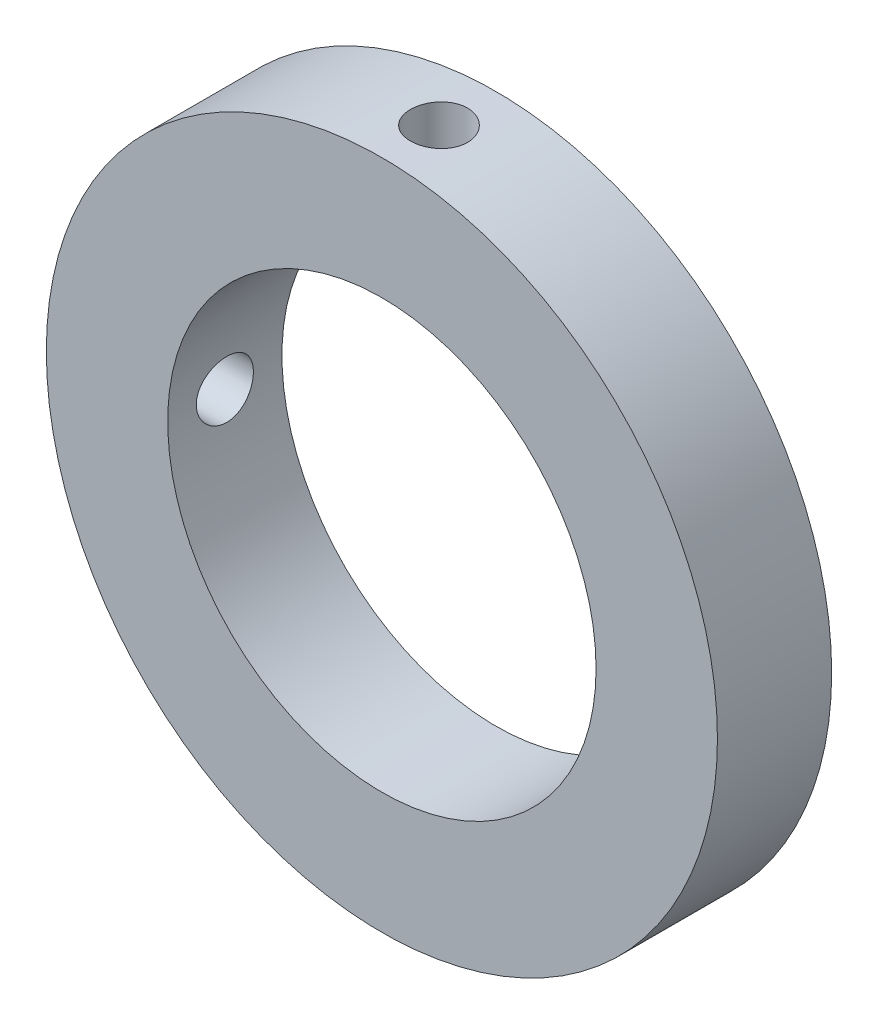
from build123d import *

# Parameters (mm, degrees)
SKETCH1_R               = 23.5
SKETCH1_R_2             = 15
BOSS_EXTRUDE1_DEPTH     = 8
CUT_EXTRUDE1_REACH      = 55.153
CUT_EXTRUDE1_END_RADIUS = 15
SKETCH3_R               = 2
CIRPATTERN1_COUNT       = 2
CIRPATTERN1_ANGLE       = 90


with BuildPart() as part:
    # Sketch1 → Boss-Extrude1 (new body)
    with BuildSketch(Plane.XY):
        Circle(SKETCH1_R)
        Circle(SKETCH1_R_2, mode=Mode.SUBTRACT)
    extrude(amount=BOSS_EXTRUDE1_DEPTH)

    # Cut-Extrude1: up to this cylinder (the profile starts outside it)
    cut_extrude1_end = Plane(origin=(0, 0, 4), z_dir=(0, 0, -1)) * Cylinder(CUT_EXTRUDE1_END_RADIUS, 141.306, mode=Mode.PRIVATE)
    # Sketch3 → Cut-Extrude1 (cut, up to the surface)
    with BuildSketch(Plane(origin=(0, 23.5, 8), x_dir=(1, 0, 0), z_dir=(0, 1, 0)), mode=Mode.PRIVATE) as cut_extrude1_sk1:
        with Locations(Location((0, 4, 0), (0, 0, 270))):
            Circle(SKETCH3_R)
    cut_extrude1_tool1 = extrude(cut_extrude1_sk1.sketch, amount=-CUT_EXTRUDE1_REACH, mode=Mode.PRIVATE) - cut_extrude1_end
    cut_extrude1 = cut_extrude1_tool1.solids().sort_by_distance((0, 23.5, 4))[0]
    add(cut_extrude1, mode=Mode.SUBTRACT)

    # CirPattern1: Cut-Extrude1 ×2 about axis
    cirpattern1_axis = Axis((0, 0, 8), (0, 0, 1))
    for i in range(1, CIRPATTERN1_COUNT):
        add(cut_extrude1.rotate(cirpattern1_axis, i * CIRPATTERN1_ANGLE / (CIRPATTERN1_COUNT - 1)), mode=Mode.SUBTRACT)


solid = part.part
